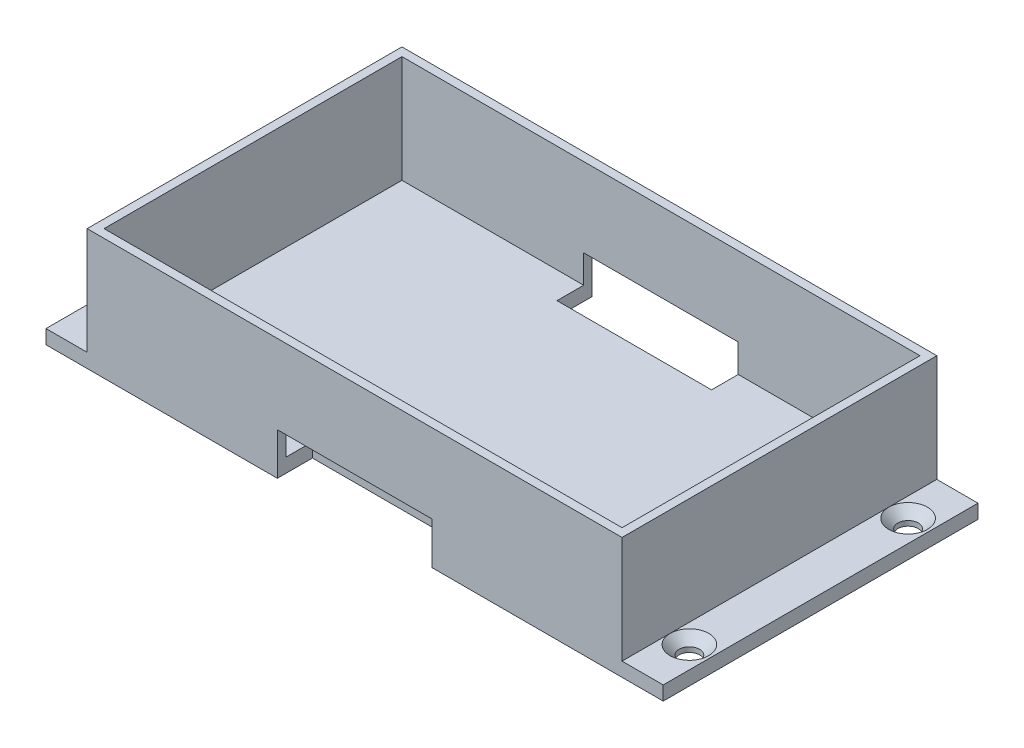
from build123d import *

# Parameters (mm, degrees)
SKETCH1_W                                    = 87.86
SKETCH1_H                                    = 44.81
BOSS_EXTRUDE1_DEPTH                          = 2
CSK_FOR_M2_5_COUNTERSUNK_FLAT_HEAD_S_2_COUNT = 2
CSK_FOR_M2_5_COUNTERSUNK_FLAT_HEAD_S_2_PITCH = 31.13
CSK_FOR_M2_5_COUNTERSUNK_FLAT_HEAD_S_3_COUNT = 2
CSK_FOR_M2_5_COUNTERSUNK_FLAT_HEAD_S_3_PITCH = 87.373717444
CSK_FOR_M2_5_COUNTERSUNK_FLAT_HEAD_S_4_COUNT = 2
CSK_FOR_M2_5_COUNTERSUNK_FLAT_HEAD_S_4_PITCH = 81.64
BOSS_EXTRUDE2_DEPTH                          = 15.25
BOSS_EXTRUDE3_DEPTH                          = 15.25
CUT_EXTRUDE1_DEPTH                           = 50
CUT_EXTRUDE1_DEPTH_BACK                      = 15.25
CUT_EXTRUDE4_DEPTH                           = 15.25
SKETCH11_W                                   = 22
SKETCH11_H                                   = 5
CUT_EXTRUDE5_DEPTH                           = 15.25


with BuildPart() as part:
    # Sketch1 → Boss-Extrude1 (new body)
    with BuildSketch(Plane(origin=(0, 0, 0), x_dir=(1, 0, 0), z_dir=(0, 1, 0))):
        Rectangle(SKETCH1_W, SKETCH1_H)
    extrude(amount=BOSS_EXTRUDE1_DEPTH)

    # Sketch3 → CSK for M2.5 Countersunk Flat Head Screw1 (revolve, cut)
    with BuildSketch(Plane(origin=(-40.82, 2, -15.565), x_dir=(0, 0, 1), z_dir=(1, 0, 0))):
        Polygon((0, 0), (0, 2), (1.45, 2), (1.45, 1.3), (2.75, 0), align=None)
    csk_for_m2_5_countersunk_flat_head_screw = revolve(axis=Axis((-40.82, 8.35, -15.565), (0, -1, 0)), mode=Mode.SUBTRACT)

    # CSK for M2.5 Countersunk Flat Head S 2: CSK for M2.5 Countersunk Flat Head Screw1 ×2
    with Locations(*[(0, 0, i * CSK_FOR_M2_5_COUNTERSUNK_FLAT_HEAD_S_2_PITCH) for i in range(1, CSK_FOR_M2_5_COUNTERSUNK_FLAT_HEAD_S_2_COUNT)]):
        add(csk_for_m2_5_countersunk_flat_head_screw, mode=Mode.SUBTRACT)

    # CSK for M2.5 Countersunk Flat Head S 3: CSK for M2.5 Countersunk Flat Head Screw1 ×2
    with Locations(*[Vector(0.9343770917408808, 0, 0.35628563040046085) * (i * CSK_FOR_M2_5_COUNTERSUNK_FLAT_HEAD_S_3_PITCH) for i in range(1, CSK_FOR_M2_5_COUNTERSUNK_FLAT_HEAD_S_3_COUNT)]):
        add(csk_for_m2_5_countersunk_flat_head_screw, mode=Mode.SUBTRACT)

    # CSK for M2.5 Countersunk Flat Head S 4: CSK for M2.5 Countersunk Flat Head Screw1 ×2
    with Locations(*[(i * CSK_FOR_M2_5_COUNTERSUNK_FLAT_HEAD_S_4_PITCH, 0, 0) for i in range(1, CSK_FOR_M2_5_COUNTERSUNK_FLAT_HEAD_S_4_COUNT)]):
        add(csk_for_m2_5_countersunk_flat_head_screw, mode=Mode.SUBTRACT)

    # Sketch5 → Boss-Extrude2 (add)
    with BuildSketch(Plane(origin=(0, 2, 0), x_dir=(1, 0, 0), z_dir=(0, 1, 0))):
        Polygon((-38.07, 15.565), (-38.07, 22.405), (-36.87, 22.405), (-36.87, -22.405), (-38.07, -22.405), align=None)
    extrude(amount=BOSS_EXTRUDE2_DEPTH)

    # Sketch6 → Boss-Extrude3 (add)
    with BuildSketch(Plane(origin=(0, 2, 0), x_dir=(1, 0, 0), z_dir=(0, 1, 0))):
        Polygon((-36.87, 22.405), (38.07, 22.405), (38.07, -22.405), (-36.87, -22.405), (-36.87, -21.205), (36.87, -21.205), (36.87, 21.205), (-36.87, 21.205), align=None)
    extrude(amount=BOSS_EXTRUDE3_DEPTH)

    # Sketch7 → Cut-Extrude1 (cut, two sides: drawn at the far end of the back side and taken through both)
    with BuildSketch(Plane.XY.offset(-21.205).offset(-CUT_EXTRUDE1_DEPTH_BACK)):
        Polygon((0, 2), (-11, 2), (-11, 6), (11, 6), (11, 2), align=None)
    extrude(amount=CUT_EXTRUDE1_DEPTH + CUT_EXTRUDE1_DEPTH_BACK, mode=Mode.SUBTRACT)

    # Sketch10 → Cut-Extrude4 (cut)
    with BuildSketch(Plane(origin=(0, 2, 0), x_dir=(1, 0, 0), z_dir=(0, 1, 0))):
        Polygon((-11, 21.205), (-11, 22.405), (11, 22.405), (11, 17.405), (-11, 17.405), align=None)
    extrude(amount=-CUT_EXTRUDE4_DEPTH, mode=Mode.SUBTRACT)

    # Sketch11 → Cut-Extrude5 (cut)
    with BuildSketch(Plane(origin=(0, 2, 0), x_dir=(1, 0, 0), z_dir=(0, 1, 0))):
        with Locations((0, -19.905)):
            Rectangle(SKETCH11_W, SKETCH11_H)
    extrude(amount=-CUT_EXTRUDE5_DEPTH, mode=Mode.SUBTRACT)


solid = part.part
